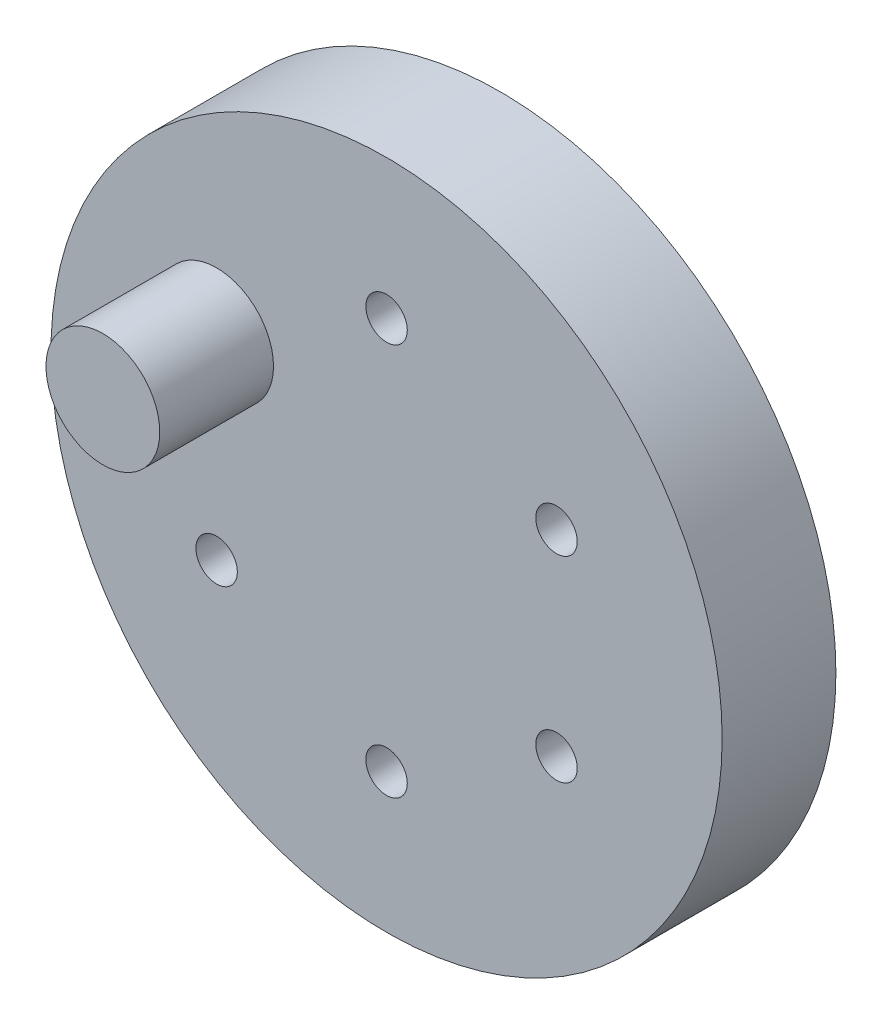
from build123d import *

# Parameters (mm, degrees)
SKETCH_1_R      = 29.5
SKETCH_1_R_2    = 1.82136949
EXTRUDE_1_DEPTH = 10
SKETCH_2_R      = 5
EXTRUDE_2_DEPTH = 10


with BuildPart() as part:
    # 草图1 → 凸台-拉伸1 (new body)
    with BuildSketch(Plane.XY):
        Circle(SKETCH_1_R)
        with Locations((0, 17.25)):
            Circle(SKETCH_1_R_2, mode=Mode.SUBTRACT)
        with Locations((14.938938215, 8.625)):
            Circle(SKETCH_1_R_2, mode=Mode.SUBTRACT)
        with Locations((14.938938215, -8.625)):
            Circle(SKETCH_1_R_2, mode=Mode.SUBTRACT)
        with Locations((0, -17.25)):
            Circle(SKETCH_1_R_2, mode=Mode.SUBTRACT)
        with Locations((-14.938938215, -8.625)):
            Circle(SKETCH_1_R_2, mode=Mode.SUBTRACT)
        with Locations((-14.938938215, 8.625)):
            Circle(SKETCH_1_R_2, mode=Mode.SUBTRACT)
    extrude(amount=EXTRUDE_1_DEPTH)

    # 草图2 → 凸台-拉伸2 (add)
    with BuildSketch(Plane.XY.offset(10)):
        with Locations((-14.938938215, 8.625)):
            Circle(SKETCH_2_R)
    extrude(amount=EXTRUDE_2_DEPTH)


solid = part.part
